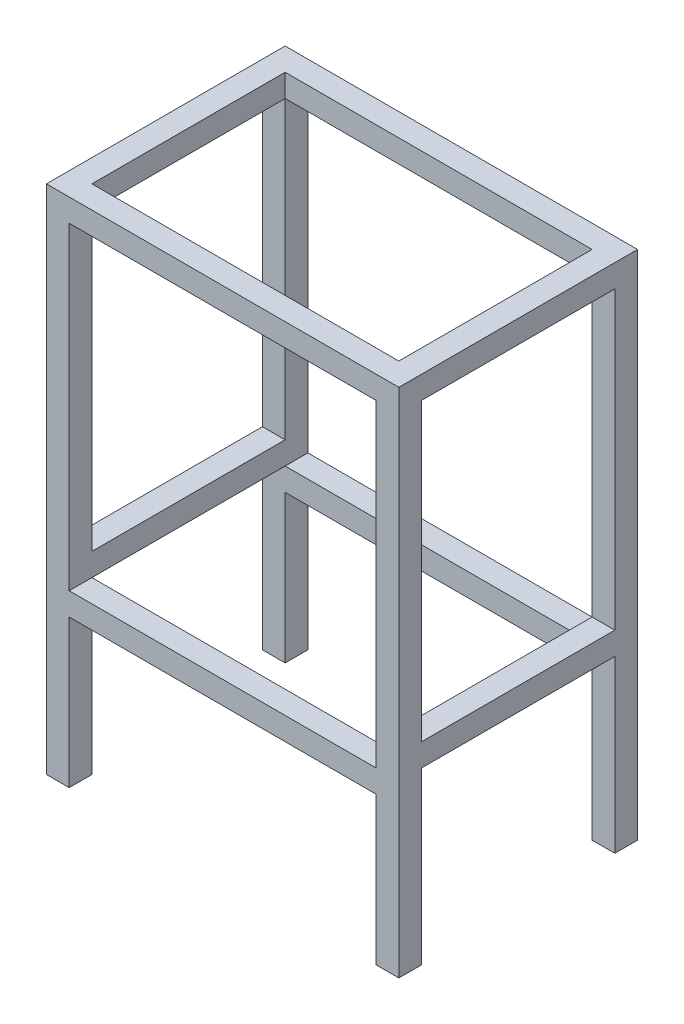
from build123d import *

# Parameters (mm, degrees)
SKETCH_1_W          = 310
SKETCH_1_H          = 210
SKETCH_1_W_2        = 270
SKETCH_1_H_2        = 170
EXTRUDE_1_DEPTH     = 450
SKETCH_8_W          = 170
SKETCH_8_H          = 260
CUT_EXTRUDE_3_DEPTH = 310
SKETCH_11_W         = 170
SKETCH_11_H         = 150
CUT_EXTRUDE_4_DEPTH = 310
SKETCH_13_W         = 270
SKETCH_13_H         = 130
CUT_EXTRUDE_5_DEPTH = 521.216301167
SKETCH_14_W         = 270
SKETCH_14_H         = 280
CUT_EXTRUDE_6_DEPTH = 525.332909515


with BuildPart() as part:
    # 草图1 → 凸台-拉伸1 (new body)
    with BuildSketch(Plane(origin=(0, 0, 0), x_dir=(1, 0, 0), z_dir=(0, 1, 0))):
        Rectangle(SKETCH_1_W, SKETCH_1_H)
        Rectangle(SKETCH_1_W_2, SKETCH_1_H_2, mode=Mode.SUBTRACT)
    extrude(amount=EXTRUDE_1_DEPTH)

    # 草图8 → 切除-拉伸3 (cut)
    with BuildSketch(Plane(origin=(155, 0, 0), x_dir=(0, 0, -1), z_dir=(1, 0, 0))):
        with Locations((0, 300)):
            Rectangle(SKETCH_8_W, SKETCH_8_H)
    extrude(amount=-CUT_EXTRUDE_3_DEPTH, mode=Mode.SUBTRACT)

    # 草图11 → 切除-拉伸4 (cut)
    with BuildSketch(Plane(origin=(155, 0, 0), x_dir=(0, 0, -1), z_dir=(1, 0, 0))):
        with Locations((0, 75)):
            Rectangle(SKETCH_11_W, SKETCH_11_H)
    extrude(amount=-CUT_EXTRUDE_4_DEPTH, mode=Mode.SUBTRACT)

    # 草图13 → 切除-拉伸5 (cut, through all)
    with BuildSketch(Plane.XY.offset(105)):
        with Locations((0, 65)):
            Rectangle(SKETCH_13_W, SKETCH_13_H)
    extrude(amount=-CUT_EXTRUDE_5_DEPTH, mode=Mode.SUBTRACT)

    # 草图14 → 切除-拉伸6 (cut, through all)
    with BuildSketch(Plane.XY.offset(115)):
        with Locations((0, 290)):
            Rectangle(SKETCH_14_W, SKETCH_14_H)
    extrude(amount=-CUT_EXTRUDE_6_DEPTH, mode=Mode.SUBTRACT)


solid = part.part
